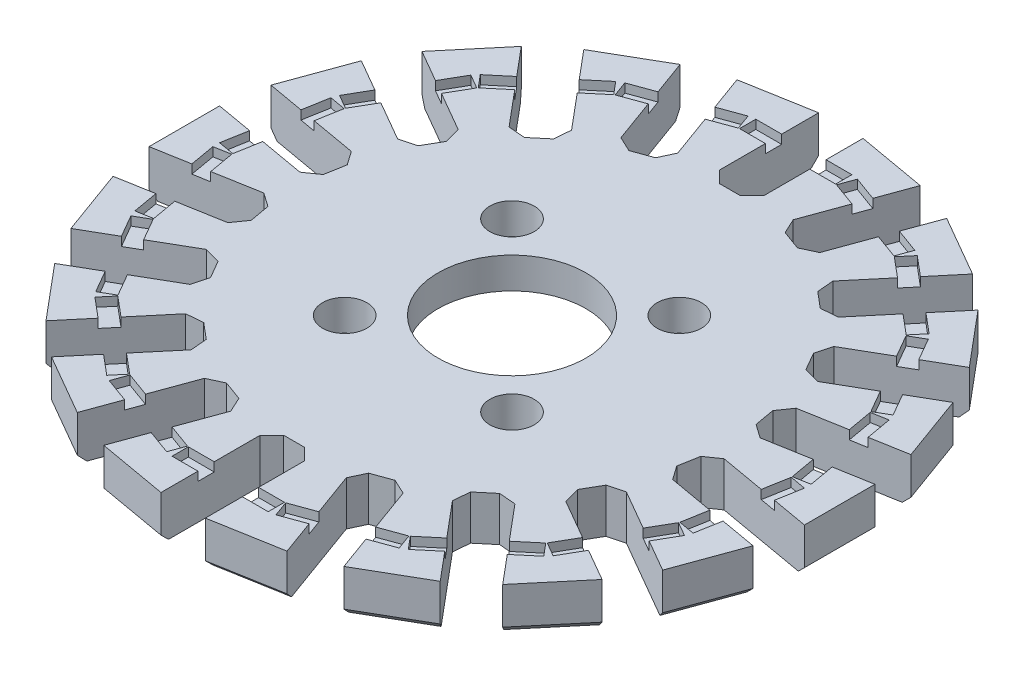
from build123d import *

# Parameters (mm, degrees)
BOSS_EXTRUDE1_DEPTH = 3
CHAMFER1_SIZE       = 0.8
SKETCH2_W           = 6.5
SKETCH2_H           = 1.1
CUT_EXTRUDE1_DEPTH  = 0.6
CHAMFER2_SIZE       = 0.5
SKETCH4_R           = 1.5
CUT_EXTRUDE4_DEPTH  = 3
SKETCH5_R           = 5
CUT_EXTRUDE5_DEPTH  = 3
SKETCH6_R           = 11
CUT_EXTRUDE6_DEPTH  = 0.9


with BuildPart() as part:
    # Sketch1 → Boss-Extrude1 (new body)
    with BuildSketch(Plane(origin=(0, 0, 0), x_dir=(1, 0, 0), z_dir=(0, 1, 0))):
        Polygon((-1.5, 22.235509529), (-1.5, 14.735509529), (1.5, 14.735509529), (1.5, 22.235509529), (6.195453225, 21.407574439), (3.63030215, 14.359879783), (6.449380012, 13.333819353), (9.014531087, 20.381514009), (13.143643356, 17.997569929), (8.322736283, 12.252236606), (10.620869612, 10.323873777), (15.441776685, 16.0692071), (18.506516118, 12.41679287), (12.01132559, 8.66679287), (13.51132559, 6.068716659), (20.006516118, 9.818716659), (21.63722991, 5.338367339), (14.251171762, 4.036006006), (14.772116295, 1.081582747), (22.158174443, 2.38394408), (22.158174443, -2.38394408), (14.772116295, -1.081582747), (14.251171762, -4.036006006), (21.63722991, -5.338367339), (20.006516118, -9.818716659), (13.51132559, -6.068716659), (12.01132559, -8.66679287), (18.506516118, -12.41679287), (15.441776685, -16.0692071), (10.620869612, -10.323873777), (8.322736283, -12.252236606), (13.143643356, -17.997569929), (9.014531087, -20.381514009), (6.449380012, -13.333819353), (3.63030215, -14.359879783), (6.195453225, -21.407574439), (1.5, -22.235509529), (1.5, -14.735509529), (-1.5, -14.735509529), (-1.5, -22.235509529), (-6.195453225, -21.407574439), (-3.63030215, -14.359879783), (-6.449380012, -13.333819353), (-9.014531087, -20.381514009), (-13.143643356, -17.997569929), (-8.322736283, -12.252236606), (-10.620869612, -10.323873777), (-15.441776685, -16.0692071), (-18.506516118, -12.41679287), (-12.01132559, -8.66679287), (-13.51132559, -6.068716659), (-20.006516118, -9.818716659), (-21.63722991, -5.338367339), (-14.251171762, -4.036006006), (-14.772116295, -1.081582747), (-22.158174443, -2.38394408), (-22.158174443, 2.38394408), (-14.772116295, 1.081582747), (-14.251171762, 4.036006006), (-21.63722991, 5.338367339), (-20.006516118, 9.818716659), (-13.51132559, 6.068716659), (-12.01132559, 8.66679287), (-18.506516118, 12.41679287), (-15.441776685, 16.0692071), (-10.620869612, 10.323873777), (-8.322736283, 12.252236606), (-13.143643356, 17.997569929), (-9.014531087, 20.381514009), (-6.449380012, 13.333819353), (-3.63030215, 14.359879783), (-6.195453225, 21.407574439), align=None)
    extrude(amount=BOSS_EXTRUDE1_DEPTH)

    # Chamfer1
    chamfer1_edges = [part.edges().sort_by_distance(p)[0] for p in [
        (-1.5, 1.5, -14.735509529),
        (1.5, 1.5, -14.735509529),
        (3.63030215, 1.5, -14.359879783),
        (6.449380012, 1.5, -13.333819353),
        (8.322736283, 1.5, -12.252236606),
        (10.620869612, 1.5, -10.323873777),
        (12.01132559, 1.5, -8.66679287),
        (13.51132559, 1.5, -6.068716659),
        (14.251171762, 1.5, -4.036006006),
        (14.772116295, 1.5, -1.081582747),
        (14.772116295, 1.5, 1.081582747),
        (14.251171762, 1.5, 4.036006006),
        (13.51132559, 1.5, 6.068716659),
        (12.01132559, 1.5, 8.66679287),
        (10.620869612, 1.5, 10.323873777),
        (8.322736283, 1.5, 12.252236606),
        (6.449380012, 1.5, 13.333819353),
        (3.63030215, 1.5, 14.359879783),
        (1.5, 1.5, 14.735509529),
        (-1.5, 1.5, 14.735509529),
        (-3.63030215, 1.5, 14.359879783),
        (-6.449380012, 1.5, 13.333819353),
        (-8.322736283, 1.5, 12.252236606),
        (-10.620869612, 1.5, 10.323873777),
        (-12.01132559, 1.5, 8.66679287),
        (-13.51132559, 1.5, 6.068716659),
        (-14.251171762, 1.5, 4.036006006),
        (-14.772116295, 1.5, 1.081582747),
        (-14.772116295, 1.5, -1.081582747),
        (-14.251171762, 1.5, -4.036006006),
        (-13.51132559, 1.5, -6.068716659),
        (-12.01132559, 1.5, -8.66679287),
        (-10.620869612, 1.5, -10.323873777),
        (-8.322736283, 1.5, -12.252236606),
        (-6.449380012, 1.5, -13.333819353),
        (-3.63030215, 1.5, -14.359879783),
    ]]
    chamfer(chamfer1_edges, length=CHAMFER1_SIZE)

    # Sketch2 → Cut-Extrude1 (cut)
    with BuildSketch(Plane(origin=(0, 3, 0), x_dir=(1, 0, 0), z_dir=(0, 1, 0))):
        with Locations((0, 19.185509529)):
            Rectangle(SKETCH2_W, SKETCH2_H)
        Polygon((3.319718622, 18.623216255), (3.69594078, 19.656878138), (9.803942815, 17.433747206), (9.427720658, 16.400085323), align=None)
        Polygon((9.489030185, 16.364688251), (10.196096556, 17.207337138), (15.175385436, 13.029217675), (14.468319066, 12.186568788), align=None)
        Polygon((14.513824665, 12.132337327), (15.466452609, 12.682337327), (18.716452609, 7.053172202), (17.763824665, 6.503172202), align=None)
        Polygon((17.788037688, 6.436647467), (18.871326216, 6.627660462), (20.000039371, 0.226410068), (18.916750843, 0.035397072), align=None)
        Polygon((18.916750843, -0.035397072), (20.000039371, -0.226410068), (18.871326216, -6.627660462), (17.788037688, -6.436647467), align=None)
        Polygon((17.763824665, -6.503172202), (18.716452609, -7.053172202), (15.466452609, -12.682337327), (14.513824665, -12.132337327), align=None)
        Polygon((14.468319066, -12.186568788), (15.175385436, -13.029217675), (10.196096556, -17.207337138), (9.489030185, -16.364688251), align=None)
        Polygon((9.427720658, -16.400085323), (9.803942815, -17.433747206), (3.69594078, -19.656878138), (3.319718622, -18.623216255), align=None)
        with Locations((0, -19.185509529)):
            Rectangle(SKETCH2_W, SKETCH2_H)
        Polygon((-3.319718622, -18.623216255), (-3.69594078, -19.656878138), (-9.803942815, -17.433747206), (-9.427720658, -16.400085323), align=None)
        Polygon((-9.489030185, -16.364688251), (-10.196096556, -17.207337138), (-15.175385436, -13.029217675), (-14.468319066, -12.186568788), align=None)
        Polygon((-14.513824665, -12.132337327), (-15.466452609, -12.682337327), (-18.716452609, -7.053172202), (-17.763824665, -6.503172202), align=None)
        Polygon((-17.788037688, -6.436647467), (-18.871326216, -6.627660462), (-20.000039371, -0.226410068), (-18.916750843, -0.035397072), align=None)
        Polygon((-18.916750843, 0.035397072), (-20.000039371, 0.226410068), (-18.871326216, 6.627660462), (-17.788037688, 6.436647467), align=None)
        Polygon((-17.763824665, 6.503172202), (-18.716452609, 7.053172202), (-15.466452609, 12.682337327), (-14.513824665, 12.132337327), align=None)
        Polygon((-14.468319066, 12.186568788), (-15.175385436, 13.029217675), (-10.196096556, 17.207337138), (-9.489030185, 16.364688251), align=None)
        Polygon((-9.427720658, 16.400085323), (-9.803942815, 17.433747206), (-3.69594078, 19.656878138), (-3.319718622, 18.623216255), align=None)
    extrude(amount=-CUT_EXTRUDE1_DEPTH, mode=Mode.SUBTRACT)

    # Chamfer2
    chamfer2_edges = [part.edges().sort_by_distance(p)[0] for p in [
        (3.847726612, 0, -21.821541984),
        (11.079087221, 0, -19.189541969),
        (16.974146402, 0, -14.242999985),
        (20.821873014, 0, -7.578541999),
        (22.158174443, 0, 0),
        (20.821873014, 0, 7.578541999),
        (16.974146402, 0, 14.242999985),
        (11.079087221, 0, 19.189541969),
        (3.847726612, 0, 21.821541984),
        (-3.847726612, 0, 21.821541984),
        (-11.079087221, 0, 19.189541969),
        (-16.974146402, 0, 14.242999985),
        (-20.821873014, 0, 7.578541999),
        (-22.158174443, 0, 0),
        (-20.821873014, 0, -7.578541999),
        (-16.974146402, 0, -14.242999985),
        (-11.079087221, 0, -19.189541969),
        (-3.847726612, 0, -21.821541984),
    ]]
    chamfer(chamfer2_edges, length=CHAMFER2_SIZE)

    # Sketch4 → Cut-Extrude4 (cut)
    with BuildSketch(Plane.XZ):
        with Locations(Location((-5.656854249, 5.656854249, 0), (0, 0, 270))):
            Circle(SKETCH4_R)
        with Locations(Location((5.656854249, 5.656854249, 0), (0, 0, 270))):
            Circle(SKETCH4_R)
        with Locations(Location((5.656854249, -5.656854249, 0), (0, 0, 270))):
            Circle(SKETCH4_R)
        with Locations(Location((-5.656854249, -5.656854249, 0), (0, 0, 270))):
            Circle(SKETCH4_R)
    extrude(amount=-CUT_EXTRUDE4_DEPTH, mode=Mode.SUBTRACT)

    # Sketch5 → Cut-Extrude5 (cut)
    with BuildSketch(Plane.XZ):
        with Locations(Location((0, 0, 0), (0, 0, 270))):
            Circle(SKETCH5_R)
    extrude(amount=-CUT_EXTRUDE5_DEPTH, mode=Mode.SUBTRACT)

    # Sketch6 → Cut-Extrude6 (cut)
    with BuildSketch(Plane.XZ):
        with Locations(Location((0, 0, 0), (0, 0, 270))):
            Circle(SKETCH6_R)
    extrude(amount=-CUT_EXTRUDE6_DEPTH, mode=Mode.SUBTRACT)


solid = part.part
